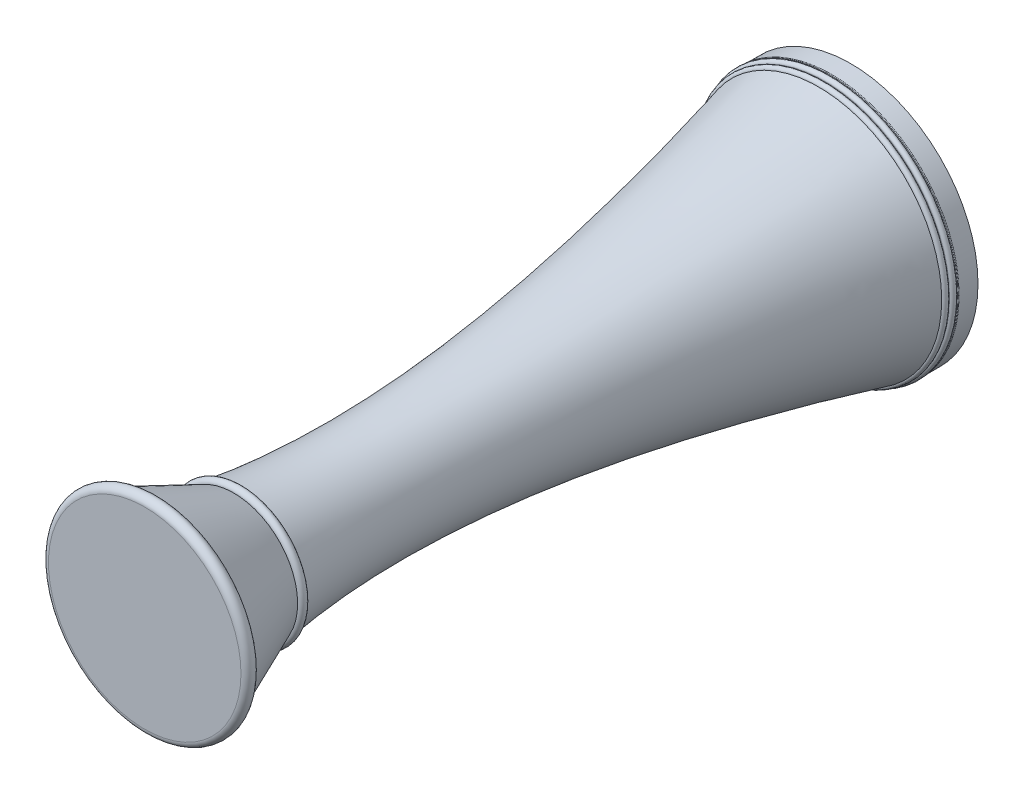
from build123d import *

# Parameters (mm, degrees)
SKETCH1_R           = 5
BOSS_EXTRUDE1_DEPTH = 0.75
SKETCH14_R          = 2.510233687
BOSS_EXTRUDE2_DEPTH = 3
BOSS_EXTRUDE2_DRAFT = -23


with BuildPart() as part:
    # Sketch1 → Boss-Extrude1 (new body)
    with BuildSketch(Plane.XY):
        Circle(SKETCH1_R)
    extrude(amount=BOSS_EXTRUDE1_DEPTH)

    # Sketch7 → Revolve1 (revolve)
    with BuildSketch(Plane(origin=(0, 0, 0), x_dir=(1, 0, 0), z_dir=(0, 1, 0))):
        with BuildLine():
            Line((0, -0.75), (5, -0.75))
            ThreePointArc((5, -0.75), (5.019335629, -0.769335629), (5, -0.788671258))
            Line((5, -0.788671258), (0, -0.788671258))
            Line((0, -0.788671258), (0, -0.75))
        make_face()
    revolve(axis=Axis((0, 0, 0.788671258), (0, 0, -1)))

    # Sketch8 → Revolve2 (revolve)
    with BuildSketch(Plane(origin=(0, 0, 0), x_dir=(1, 0, 0), z_dir=(0, 1, 0))):
        with BuildLine():
            Line((0, -0.788671258), (4.911108997, -0.788671258))
            ThreePointArc((4.911108997, -0.788671258), (5.029118673, -0.906680934), (4.911108997, -1.02469061))
            Line((4.911108997, -1.02469061), (0, -1.02469061))
            Line((0, -1.02469061), (0, -0.788671258))
        make_face()
    revolve(axis=Axis((0, 0, 1.02469061), (0, 0, -1)))

    # Sketch10 → Revolve3 (revolve)
    with BuildSketch(Plane(origin=(0, 0, 0), x_dir=(1, 0, 0), z_dir=(0, 1, 0))):
        with BuildLine():
            Line((0, -1.02469061), (4.835857084, -1.02469061))
            ThreePointArc((4.835857084, -1.02469061), (4.955047084, -1.14388061), (4.835857084, -1.26307061))
            Line((4.835857084, -1.26307061), (0, -1.26307061))
            Line((0, -1.26307061), (0, -1.02469061))
        make_face()
    revolve(axis=Axis((0, 0, 1.26307061), (0, 0, -1)))

    # Sketch11 → Revolve4 (revolve)
    with BuildSketch(Plane(origin=(0, 0, 0), x_dir=(1, 0, 0), z_dir=(0, 1, 0))):
        with BuildLine():
            Line((2.510233687, -23.924164981), (0, -23.924164981))
            Line((0, -23.924164981), (0, -1.26307061))
            Line((0, -1.26307061), (4.835857084, -1.26307061))
            add(Edge.make_bspline(
                [(4.835857084, -1.26307061), (1.218144342, -15.520288788), (2.510233687, -23.924164981)],
                knots=[0, 0, 0, 1, 1, 1], degree=2))
        make_face()
    revolve(axis=Axis((0, 0, 23.924164981), (0, 0, -1)))

    # Sketch12 → Revolve5 (revolve)
    with BuildSketch(Plane(origin=(0, 0, 0), x_dir=(1, 0, 0), z_dir=(0, 1, 0))):
        with BuildLine():
            Line((0, -23.924164981), (2.510233687, -23.924164981))
            ThreePointArc((2.510233687, -23.924164981), (2.676574622, -24.090505915), (2.510233687, -24.25684685))
            Line((2.510233687, -24.25684685), (0, -24.25684685))
            Line((0, -24.25684685), (0, -23.924164981))
        make_face()
    revolve(axis=Axis((0, 0, 24.25684685), (0, 0, -1)))


with BuildPart() as boss_extrude2_tool:
    # Sketch14 → Boss-Extrude2 (with draft: the straight prism first)
    with BuildSketch(Plane.XY.offset(24.25684685)):
        Circle(SKETCH14_R)
    extrude(amount=BOSS_EXTRUDE2_DEPTH)
    # Boss-Extrude2: the draft: its side faces are tilted about the plane it starts from
    boss_extrude2_sides = [boss_extrude2_tool.faces().sort_by_distance(p)[0] for p in [
        (-2.510233687, 0, 25.75684685),
    ]]
    draft(boss_extrude2_sides, Plane.XY.offset(24.25684685), BOSS_EXTRUDE2_DRAFT)


with BuildPart() as part_1:
    add(part.part)

    # Boss-Extrude2: add boss_extrude2_tool
    add(boss_extrude2_tool.part)

    # Sketch15 → Revolve6 (revolve)
    with BuildSketch(Plane(origin=(0, 0, 0), x_dir=(1, 0, 0), z_dir=(0, 1, 0))):
        with BuildLine():
            Line((0, -27.25684685), (3.783658136, -27.25684685))
            ThreePointArc((3.783658136, -27.25684685), (4.033971653, -27.507160367), (3.783658136, -27.757473884))
            Line((3.783658136, -27.757473884), (0, -27.757473884))
            Line((0, -27.757473884), (0, -27.25684685))
        make_face()
    revolve(axis=Axis((0, 0, 27.757473884), (0, 0, -1)))


solid = part_1.part
